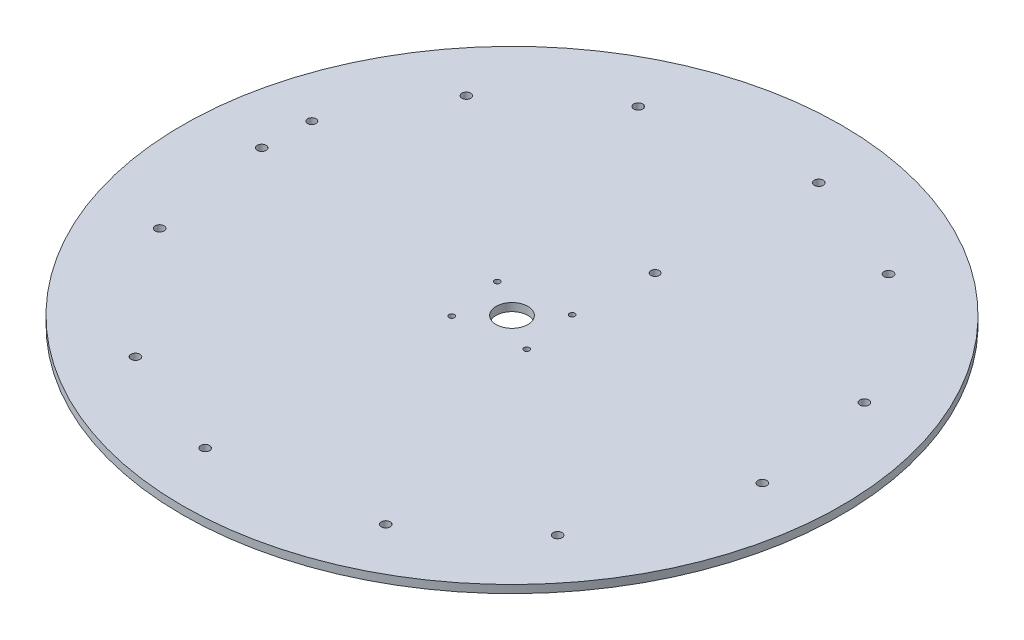
from build123d import *

# Parameters (mm, degrees)
SKETCH2_R               = 125
BOSS_EXTRUDE1_DEPTH     = 3
CUT_EXTRUDE1_START      = -26
SKETCH3_R               = 1.7
CUT_EXTRUDE1_DEPTH      = 88
CUT_EXTRUDE2_DEPTH      = 55
CUT_EXTRUDE2_DEPTH_BACK = 12
SKETCH4_R               = 6
SKETCH5_R               = 1.6
CUT_EXTRUDE3_DEPTH      = 177.802149308
CUT_EXTRUDE4_REACH      = 178.802
SKETCH6_R               = 1.05
CIRPATTERN1_COUNT       = 6


with BuildPart() as part:
    # Sketch2 → Boss-Extrude1 (new body)
    with BuildSketch(Plane(origin=(0, 0, 0), x_dir=(1, 0, 0), z_dir=(0, 1, 0))):
        with Locations(Location((0, 0, 0), (0, 0, 270))):
            Circle(SKETCH2_R)
    extrude(amount=BOSS_EXTRUDE1_DEPTH)

    # Sketch3 → Cut-Extrude1 (cut)
    with BuildSketch(Plane(origin=(0, 3, 0), x_dir=(1, 0, 0), z_dir=(0, 1, 0)).offset(CUT_EXTRUDE1_START)):
        with Locations(Location((57.824361976, 84.994428132, 0), (0, 0, 270))):
            Circle(SKETCH3_R)
        with Locations(Location((14.606066285, 101.75643704, 0), (0, 0, 270))):
            Circle(SKETCH3_R)
        with Locations(Location((44.695152955, -92.574580495, 0), (0, 0, 270))):
            Circle(SKETCH3_R)
        with Locations(Location((80.820626333, -63.527442972, 0), (0, 0, 270))):
            Circle(SKETCH3_R)
        with Locations(Location((-102.519514931, 7.580152362, 0), (0, 0, 270))):
            Circle(SKETCH3_R)
        with Locations(Location((-95.426692618, -38.228994068, 0), (0, 0, 270))):
            Circle(SKETCH3_R)
    cut_extrude1 = extrude(amount=CUT_EXTRUDE1_DEPTH, mode=Mode.SUBTRACT)

    # Sketch4 → Cut-Extrude2 (cut, two sides: drawn at the far end of the back side and taken through both)
    with BuildSketch(Plane(origin=(0, 3, 0), x_dir=(1, 0, 0), z_dir=(0, 1, 0)).offset(-CUT_EXTRUDE2_DEPTH_BACK)):
        with Locations(Location((0, 0, 0), (0, 0, 270))):
            Circle(SKETCH4_R)
    extrude(amount=CUT_EXTRUDE2_DEPTH + CUT_EXTRUDE2_DEPTH_BACK, mode=Mode.SUBTRACT)

    # Sketch5 → Cut-Extrude3 (cut, through all)
    with BuildSketch(Plane.XZ):
        with Locations(Location((-101.778099897, -25.854755487, 0), (0, 0, 270))):
            Circle(SKETCH5_R)
        with Locations(Location((13.216774043, -41.092175458, 0), (0, 0, 270))):
            Circle(SKETCH5_R)
    extrude(amount=-CUT_EXTRUDE3_DEPTH, mode=Mode.SUBTRACT)

    # Sketch6 → Cut-Extrude4 (cut, up to next)
    with BuildSketch(Plane(origin=(0, 3, 0), x_dir=(1, 0, 0), z_dir=(0, 1, 0)), mode=Mode.PRIVATE) as cut_extrude4_sk1:
        with Locations(Location((11.198414604, 11.625148557, 0), (0, 0, 270))):
            Circle(SKETCH6_R)
    cut_extrude4_tool1 = extrude(cut_extrude4_sk1.sketch, amount=-CUT_EXTRUDE4_REACH, mode=Mode.PRIVATE) & part.part
    # Sketch6 → Cut-Extrude4 (cut, up to next)
    with BuildSketch(Plane(origin=(0, 3, 0), x_dir=(1, 0, 0), z_dir=(0, 1, 0)), mode=Mode.PRIVATE) as cut_extrude4_sk2:
        with Locations(Location((13.889158795, -8.300914364, 0), (0, 0, 270))):
            Circle(SKETCH6_R)
    cut_extrude4_tool2 = extrude(cut_extrude4_sk2.sketch, amount=-CUT_EXTRUDE4_REACH, mode=Mode.PRIVATE) & part.part
    # Sketch6 → Cut-Extrude4 (cut, up to next)
    with BuildSketch(Plane(origin=(0, 3, 0), x_dir=(1, 0, 0), z_dir=(0, 1, 0)), mode=Mode.PRIVATE) as cut_extrude4_sk3:
        with Locations(Location((-11.198414604, -11.625148557, 0), (0, 0, 270))):
            Circle(SKETCH6_R)
    cut_extrude4_tool3 = extrude(cut_extrude4_sk3.sketch, amount=-CUT_EXTRUDE4_REACH, mode=Mode.PRIVATE) & part.part
    # Sketch6 → Cut-Extrude4 (cut, up to next)
    with BuildSketch(Plane(origin=(0, 3, 0), x_dir=(1, 0, 0), z_dir=(0, 1, 0)), mode=Mode.PRIVATE) as cut_extrude4_sk4:
        with Locations(Location((-13.889158795, 8.300914364, 0), (0, 0, 270))):
            Circle(SKETCH6_R)
    cut_extrude4_tool4 = extrude(cut_extrude4_sk4.sketch, amount=-CUT_EXTRUDE4_REACH, mode=Mode.PRIVATE) & part.part
    add(cut_extrude4_tool1.solids().sort_by_distance((11.198415, 3, -11.625149))[0], mode=Mode.SUBTRACT)
    add(cut_extrude4_tool2.solids().sort_by_distance((13.889159, 3, 8.300914))[0], mode=Mode.SUBTRACT)
    add(cut_extrude4_tool3.solids().sort_by_distance((-11.198415, 3, 11.625149))[0], mode=Mode.SUBTRACT)
    add(cut_extrude4_tool4.solids().sort_by_distance((-13.889159, 3, -8.300914))[0], mode=Mode.SUBTRACT)

    # CirPattern1: Cut-Extrude1 ×6 about axis
    cirpattern1_axis = Axis((0, 0, 0), (0, 1, 0))
    for i in range(1, CIRPATTERN1_COUNT):
        add(cut_extrude1.rotate(cirpattern1_axis, i * 360 / CIRPATTERN1_COUNT), mode=Mode.SUBTRACT)


solid = part.part
